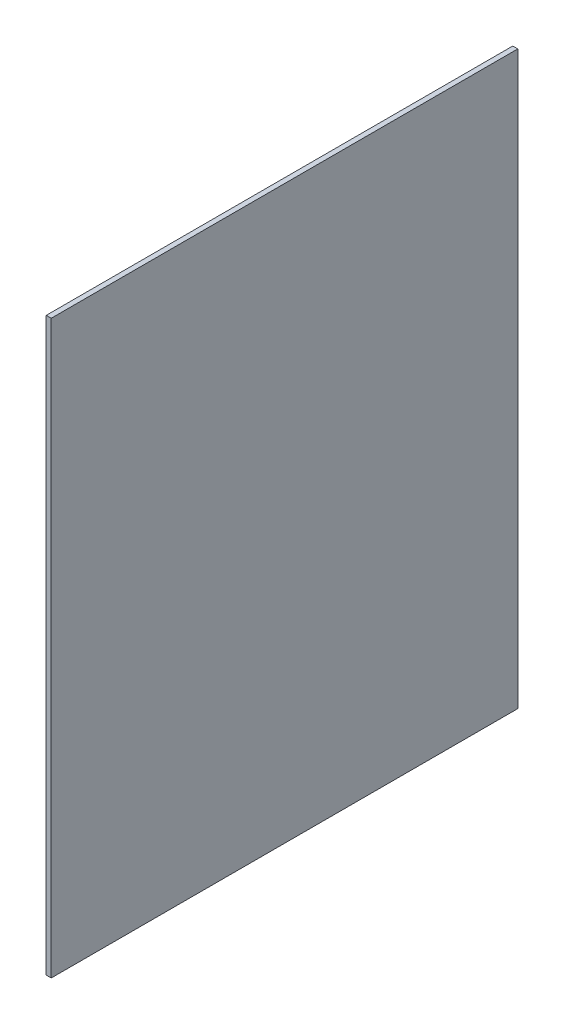
from build123d import *

# Parameters (mm, degrees)
SKETCH1_W           = 886.609411765
SKETCH1_H           = 1085.85
BOSS_EXTRUDE1_DEPTH = 9.525


with BuildPart() as part:
    # Sketch1 → Boss-Extrude1 (new body)
    with BuildSketch(Plane(origin=(0, 0, 0), x_dir=(0, 0, -1), z_dir=(1, 0, 0))):
        with Locations((406.388460487, 493.272649942)):
            Rectangle(SKETCH1_W, SKETCH1_H)
    extrude(amount=BOSS_EXTRUDE1_DEPTH)


solid = part.part
